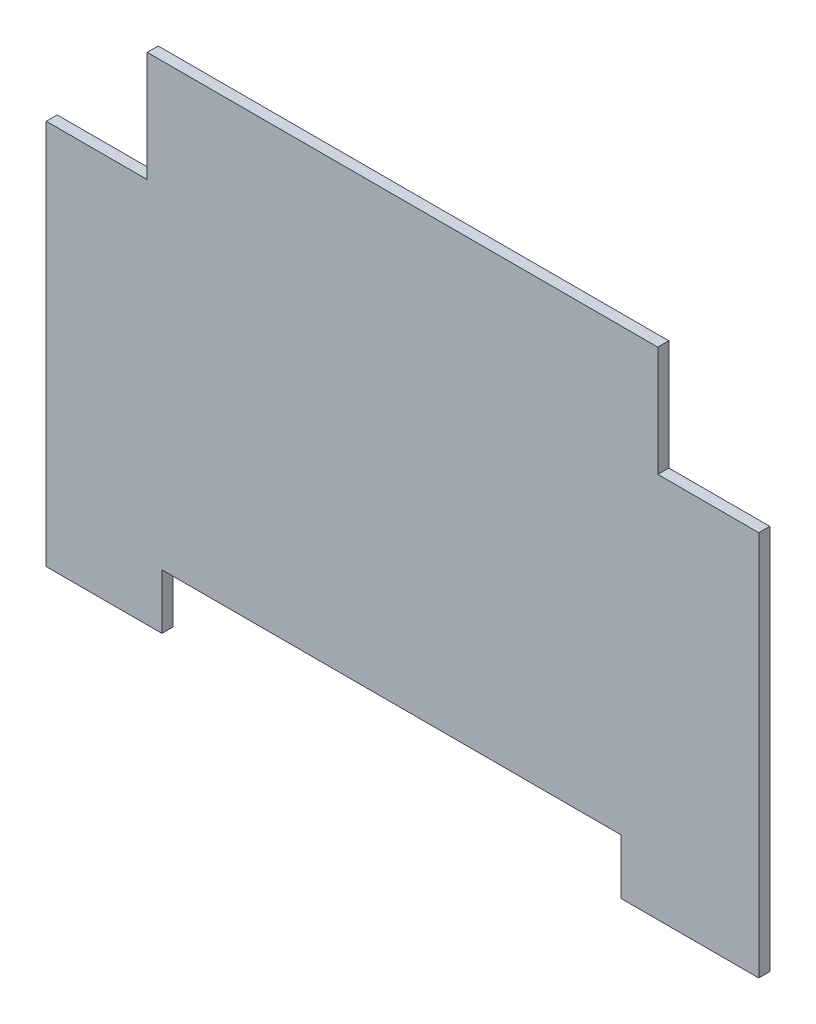
from build123d import *

# Parameters (mm, degrees)
SKETCH1_W           = 388
SKETCH1_H           = 270
BOSS_EXTRUDE1_DEPTH = 6
SKETCH2_W           = 55
SKETCH2_H           = 60
CUT_EXTRUDE1_DEPTH  = 40
SKETCH3_W           = 250
SKETCH3_H           = 30
CUT_EXTRUDE2_DEPTH  = 10


with BuildPart() as part:
    # Sketch1 → Boss-Extrude1 (new body)
    with BuildSketch(Plane.XY):
        with Locations((83.131383381, 125.666802076)):
            Rectangle(SKETCH1_W, SKETCH1_H)
    extrude(amount=BOSS_EXTRUDE1_DEPTH)

    # Sketch2 → Cut-Extrude1 (cut)
    with BuildSketch(Plane(origin=(0, 0, 0), x_dir=(-1, 0, 0), z_dir=(0, 0, -1))):
        with Locations((-249.631383381, 230.666802076)):
            Rectangle(SKETCH2_W, SKETCH2_H)
        with Locations((83.368616619, 230.666802076)):
            Rectangle(SKETCH2_W, SKETCH2_H)
    extrude(amount=-CUT_EXTRUDE1_DEPTH, mode=Mode.SUBTRACT)

    # Sketch3 → Cut-Extrude2 (cut)
    with BuildSketch(Plane(origin=(0, 0, 0), x_dir=(-1, 0, 0), z_dir=(0, 0, -1))):
        with Locations((-77.131383381, 5.666802076)):
            Rectangle(SKETCH3_W, SKETCH3_H)
    extrude(amount=-CUT_EXTRUDE2_DEPTH, mode=Mode.SUBTRACT)


solid = part.part
